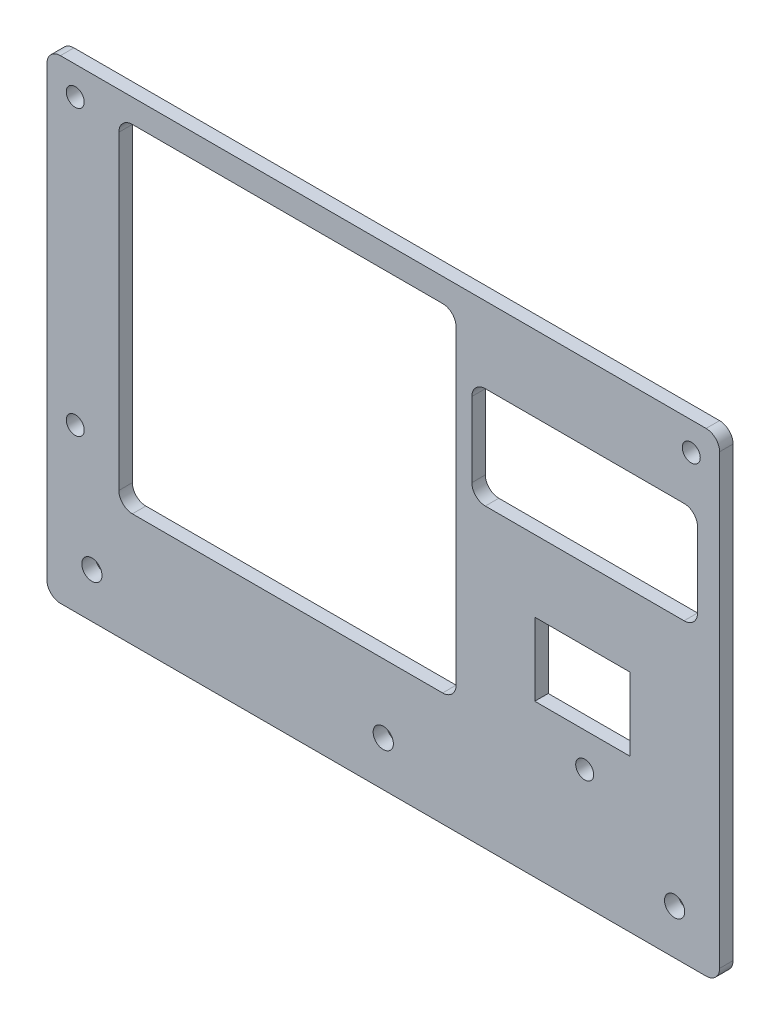
from build123d import *

# Parameters (mm, degrees)
SZKIC1_W                    = 149.6
SZKIC1_H                    = 85.5
SZKIC1_R                    = 2
SZKIC1_W_2                  = 75
SZKIC1_H_2                  = 75
SZKIC1_W_3                  = 50.2
SZKIC1_H_3                  = 22.6
SZKIC1_W_4                  = 21.2
SZKIC1_H_4                  = 16.2
SZKIC1_H_5                  = 20
SZKIC1_R_2                  = 2.25
DODANIE_WYCI_GNI_CIE1_DEPTH = 3
ZAOKR_GLENIE1_R             = 3
ZAOKR_GLENIE2_R             = 3


with BuildPart() as part:
    # Szkic1 → Dodanie-wyciągnięcie1 (new body)
    # profile 1 of 2: a face of its own
    with BuildSketch(Plane.XY):
        with Locations((0.286770428, 26.82962954)):
            Rectangle(SZKIC1_W, SZKIC1_H)
        with Locations((45.086770428, -9.62037046)):
            Circle(SZKIC1_R, mode=Mode.SUBTRACT)
        with Locations((68.786770428, 63.27962954)):
            Circle(SZKIC1_R, mode=Mode.SUBTRACT)
        with Locations((-68.213229572, 0.07962954)):
            Circle(SZKIC1_R, mode=Mode.SUBTRACT)
        with Locations((-68.213229572, 63.27962954)):
            Circle(SZKIC1_R, mode=Mode.SUBTRACT)
        with Locations((-21.013229572, 26.82962954)):
            Rectangle(SZKIC1_W_2, SZKIC1_H_2, mode=Mode.SUBTRACT)
        with Locations((45.086770428, 41.37962954)):
            Rectangle(SZKIC1_W_3, SZKIC1_H_3, mode=Mode.SUBTRACT)
        with Locations((44.586770428, 6.07962954)):
            Rectangle(SZKIC1_W_4, SZKIC1_H_4, mode=Mode.SUBTRACT)
    # profile 2 of 2: a face of its own
    with BuildSketch(Plane.XY):
        with Locations((0.286770428, -25.92037046)):
            Rectangle(SZKIC1_W, SZKIC1_H_5)
        with Locations((65.086770428, -25.92037046)):
            Circle(SZKIC1_R_2, mode=Mode.SUBTRACT)
        with Locations((0.286770428, -25.92037046)):
            Circle(SZKIC1_R_2, mode=Mode.SUBTRACT)
        with Locations((-64.513229572, -25.92037046)):
            Circle(SZKIC1_R_2, mode=Mode.SUBTRACT)
    extrude(amount=DODANIE_WYCI_GNI_CIE1_DEPTH)

    # Zaokrąglenie1
    zaokr_glenie1_edges = [part.edges().sort_by_distance(p)[0] for p in [
        (-58.513229572, 64.32962954, 1.5),
        (-58.513229572, -10.67037046, 1.5),
        (16.486770428, -10.67037046, 1.5),
        (16.486770428, 64.32962954, 1.5),
        (75.086770428, -35.92037046, 1.5),
        (-74.513229572, -35.92037046, 1.5),
        (-74.513229572, 69.57962954, 1.5),
        (75.086770428, 69.57962954, 1.5),
    ]]
    fillet(zaokr_glenie1_edges, radius=ZAOKR_GLENIE1_R)

    # Zaokrąglenie2
    zaokr_glenie2_edges = [part.edges().sort_by_distance(p)[0] for p in [
        (19.986770428, 52.67962954, 1.5),
        (19.986770428, 30.07962954, 1.5),
        (70.186770428, 30.07962954, 1.5),
        (70.186770428, 52.67962954, 1.5),
    ]]
    fillet(zaokr_glenie2_edges, radius=ZAOKR_GLENIE2_R)


solid = part.part
